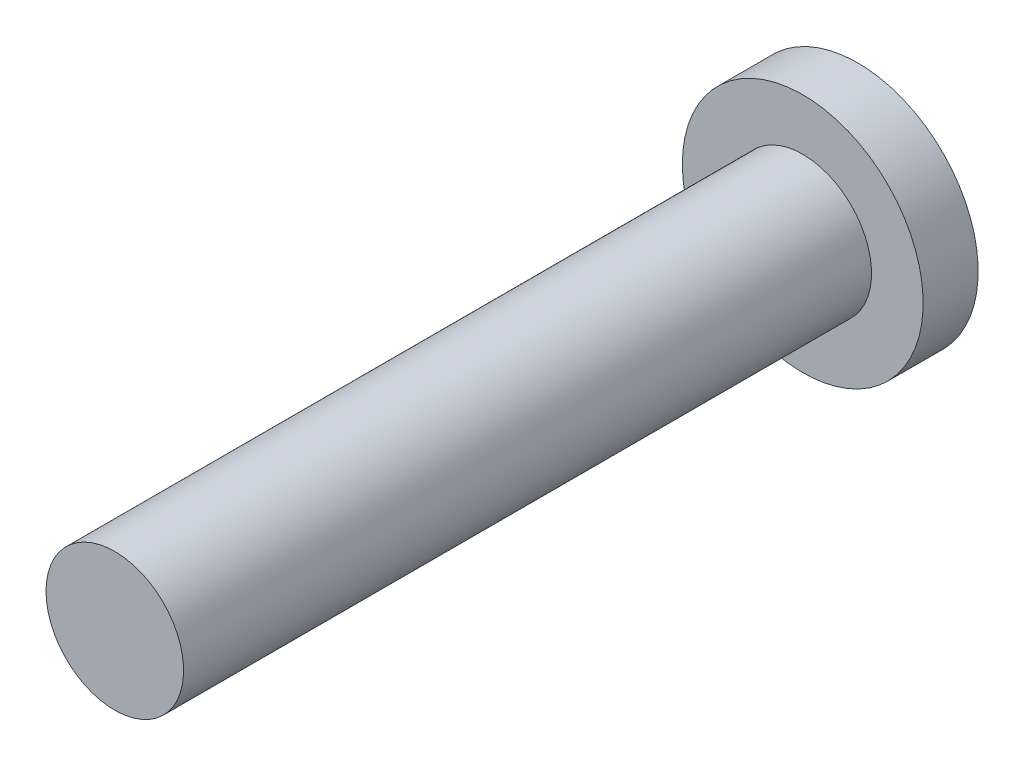
from build123d import *


with BuildPart() as part:
    # Sketch1 → Revolve1 (revolve)
    with BuildSketch(Plane(origin=(0, 0, 0), x_dir=(1, 0, 0), z_dir=(0, 1, 0)), mode=Mode.PRIVATE) as revolve1_sk:
        Polygon((0, 0), (1, 0), (1, 10), (1.75, 10), (1.75, 10.8), (0, 10.8), align=None)
    revolve(revolve1_sk.sketch.rotate(Axis((0, 0, -10.8), (0, 0, 1)), 180), axis=Axis((0, 0, -10.8), (0, 0, 1)))


solid = part.part
